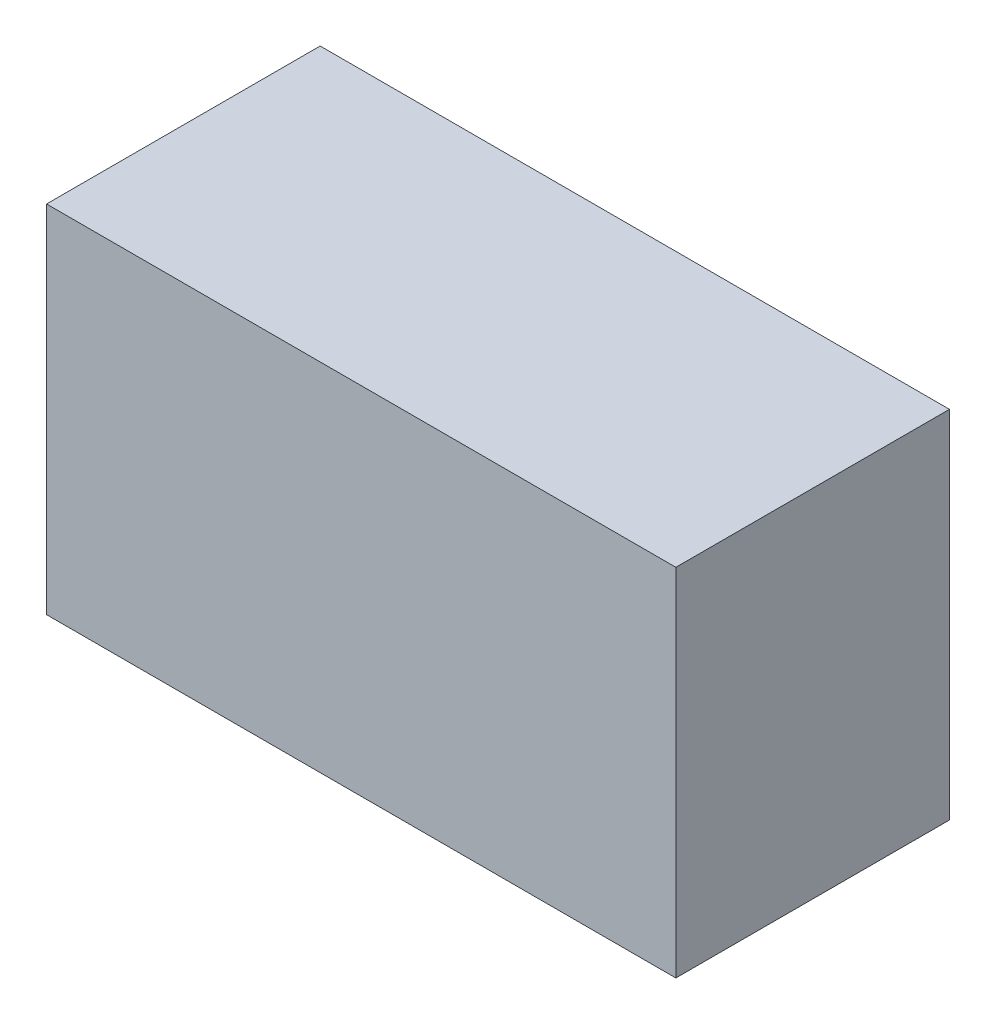
from build123d import *

# Parameters (mm, degrees)
SKETCH_1_W      = 46
SKETCH_1_H      = 26
EXTRUDE_1_DEPTH = 20


with BuildPart() as part:
    # 草图1 → 凸台-拉伸1 (new body)
    with BuildSketch(Plane.XY):
        with Locations((23, 13)):
            Rectangle(SKETCH_1_W, SKETCH_1_H)
    extrude(amount=EXTRUDE_1_DEPTH)


solid = part.part
